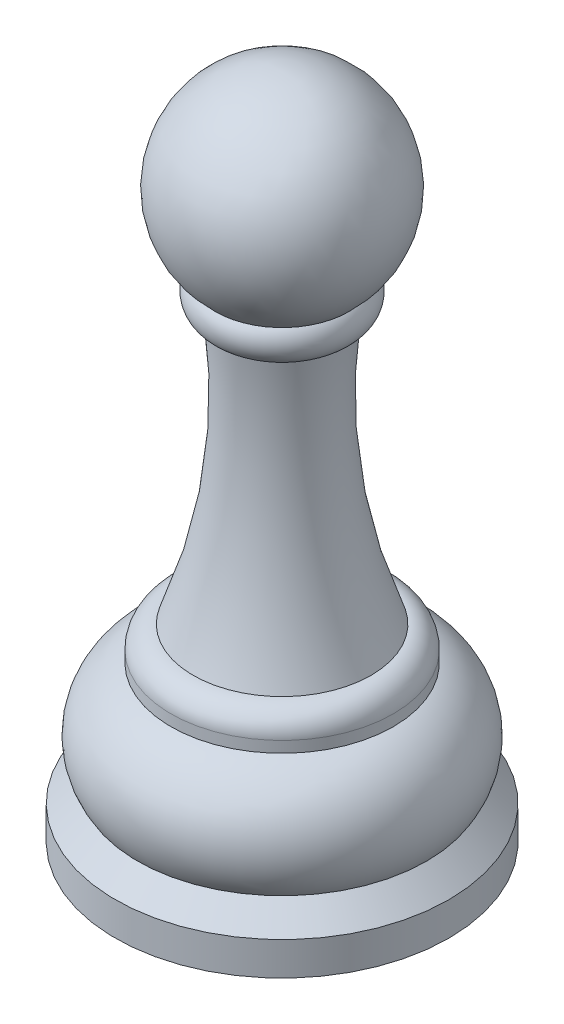
from build123d import *


with BuildPart() as part:
    # Sketch1 → Revolve3 (revolve)
    with BuildSketch(Plane.XY, mode=Mode.PRIVATE) as revolve3_sk:
        with BuildLine():
            Line((0, 0), (-15, 0))
            Line((-15, 0), (-15, 3))
            Line((-15, 3), (-13, 5))
            ThreePointArc((-13, 5), (-13.688325627, 10.216881481), (-10, 13.97))
            Line((-10, 13.97), (-10, 14.97))
            ThreePointArc((-10, 14.97), (-9.414213562, 16.384213562), (-8, 16.97))
            ThreePointArc((-8, 16.97), (-5.019495729, 28.81539847), (-5, 41.03))
            ThreePointArc((-5, 41.03), (-6.412519214, 42.380086131), (-6, 44.29))
            ThreePointArc((-6, 44.29), (-8.408390155, 54.210585037), (0, 60))
            Line((0, 60), (0, 0))
        make_face()
    revolve(revolve3_sk.sketch.rotate(Axis((0, 0, 0), (0, 1, 0)), 180), axis=Axis((0, 0, 0), (0, 1, 0)))


solid = part.part
